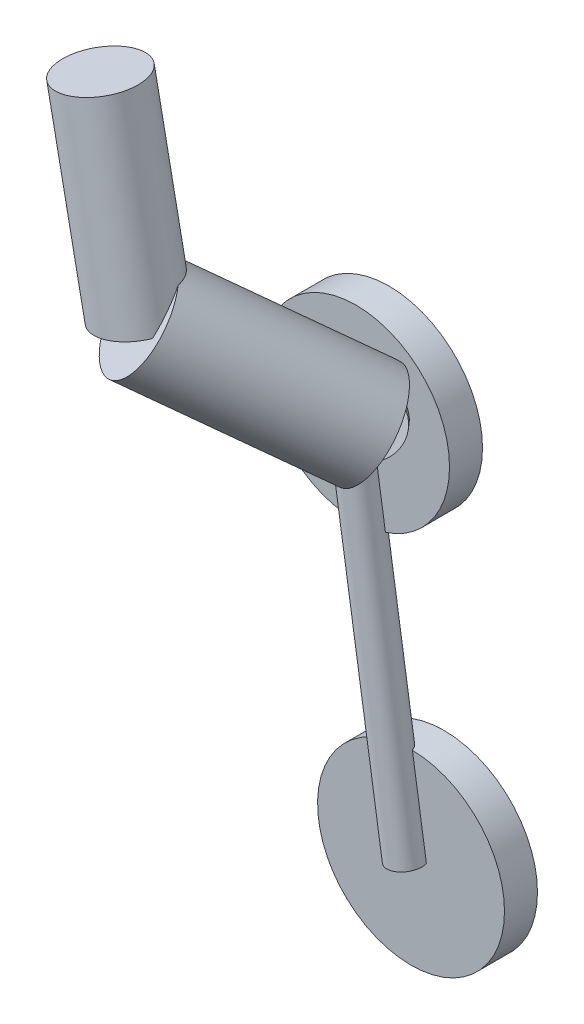
from build123d import *

# Parameters (mm, degrees)
PATILLA_PROFILE_R        = 7
PARALELOGRAMO_PROFILE_R  = 9
UNION_JAULA_PROFILE_R    = 5
JAULA_PROFILE_R          = 3
POLEA_SUPERIOR_PROFILE_R = 17
POLEA_INFERIOR_PROFILE_R = 17


with BuildPart() as part:
    # Patilla: sweep along a curve in space
    with BuildLine() as patilla_path:
        Line((-425.1, 65, 76), (-418.1, 30, 76))
    # Patilla profile (on start of the path) → Patilla (sweep)
    with BuildSketch(Plane(origin=(-425.1, 65, 76), x_dir=(-0.9805806756909202, -0.19611613513818404, 0), z_dir=(0.19611613513818404, -0.9805806756909202, 0))):
        Circle(PATILLA_PROFILE_R)
    sweep(path=patilla_path.line)

    # Paralelogramo: sweep along a curve in space
    with BuildLine() as paralelogramo_path:
        Line((-418.1, 30, 76), (-400.1, 10, 52))
    # Paralelogramo profile (on start of the path) → Paralelogramo (sweep)
    with BuildSketch(Plane(origin=(-418.1, 30, 76), x_dir=(0, -0.768221279597376, 0.6401843996644799), z_dir=(0.49923017660270624, -0.5547001962252291, -0.665640235470275))):
        Circle(PARALELOGRAMO_PROFILE_R)
    sweep(path=paralelogramo_path.line)

    # Union_jaula: sweep along a curve in space
    with BuildLine() as union_jaula_path:
        Line((-400.1, 10, 52), (-408.1, 5, 43.5))
    # Union_jaula profile (on start of the path) → Union_jaula (sweep)
    with BuildSketch(Plane(origin=(-400.1, 10, 52), x_dir=(-0.728199992692803, 0, 0.6853646990049911), z_dir=(-0.6299993847665263, -0.39374961547907894, -0.6693743463144342))):
        Circle(UNION_JAULA_PROFILE_R)
    sweep(path=union_jaula_path.line)

    # Jaula: sweep along a curve in space
    with BuildLine() as jaula_path:
        Line((-408.1, 5, 47.5), (-398.1, -60, 47.5))
    # Jaula profile (on start of the path) → Jaula (sweep)
    with BuildSketch(Plane(origin=(-408.1, 5, 47.5), x_dir=(-0.9883716976506172, -0.1520571842539411, 0), z_dir=(0.1520571842539411, -0.9883716976506172, 0))):
        Circle(JAULA_PROFILE_R)
    sweep(path=jaula_path.line)

    # Polea_superior: sweep along a curve in space
    with BuildLine() as polea_superior_path:
        Line((-408.1, 5, 40.5), (-408.1, 5, 46.5))
    # Polea_superior profile (on start of the path) → Polea_superior (sweep)
    with BuildSketch(Plane(origin=(-408.1, 5, 40.5), x_dir=(1, 0, 0), z_dir=(0, 0, 1))):
        Circle(POLEA_SUPERIOR_PROFILE_R)
    sweep(path=polea_superior_path.line)

    # Polea_inferior: sweep along a curve in space
    with BuildLine() as polea_inferior_path:
        Line((-398.1, -60, 40.5), (-398.1, -60, 46.5))
    # Polea_inferior profile (on start of the path) → Polea_inferior (sweep)
    with BuildSketch(Plane(origin=(-398.1, -60, 40.5), x_dir=(1, 0, 0), z_dir=(0, 0, 1))):
        Circle(POLEA_INFERIOR_PROFILE_R)
    sweep(path=polea_inferior_path.line)


solid = part.part
